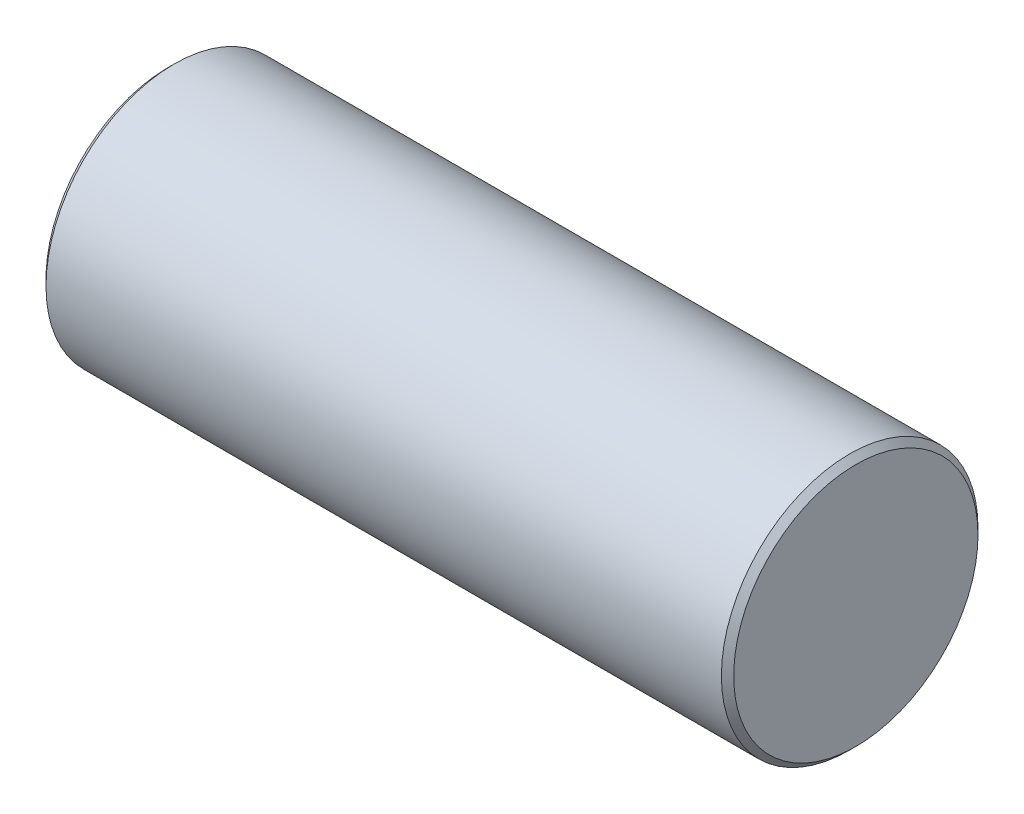
from build123d import *

# Parameters (mm, degrees)
SKETCH1_R           = 15.875
BOSS_EXTRUDE1_DEPTH = 42.545
CHAMFER1_SIZE       = 0.762


with BuildPart() as part:
    # Sketch1 → Boss-Extrude1 (new, symmetric)
    with BuildSketch(Plane(origin=(0, 0, 0), x_dir=(0, 0, -1), z_dir=(1, 0, 0))):
        Circle(SKETCH1_R)
    extrude(amount=BOSS_EXTRUDE1_DEPTH, both=True)

    # Chamfer1
    chamfer1_edges = [part.edges().sort_by_distance(p)[0] for p in [
        (-42.545, 0, 15.875),
        (42.545, 0, 15.875),
    ]]
    chamfer(chamfer1_edges, length=CHAMFER1_SIZE)


solid = part.part
